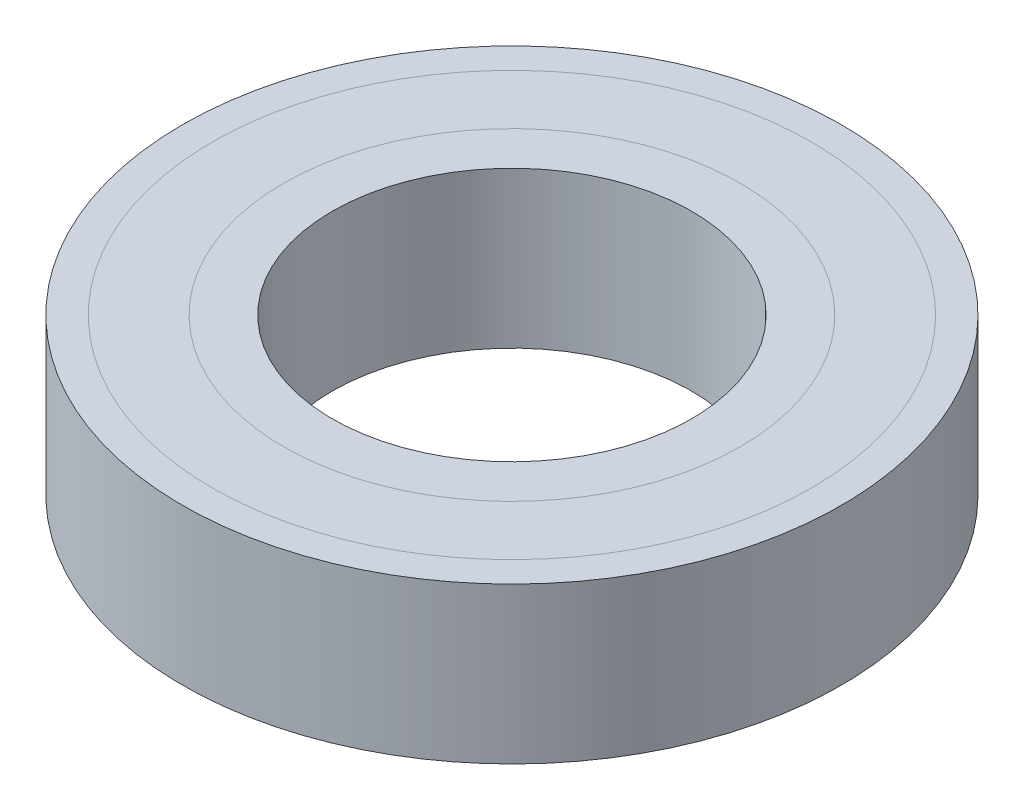
from build123d import *

# Parameters (mm, degrees)
SKETCH1_W = 12.5
SKETCH1_H = 13


with BuildPart() as part:
    # Sketch1 → Revolve1 (revolve)
    with BuildSketch(Plane.XY, mode=Mode.PRIVATE) as revolve1_sk:
        with Locations((21.25, 0)):
            Rectangle(SKETCH1_W, SKETCH1_H)
    revolve(revolve1_sk.sketch.rotate(Axis((0, 6.5, 0), (0, -1, 0)), 180), axis=Axis((0, 6.5, 0), (0, -1, 0)))


solid = part.part
